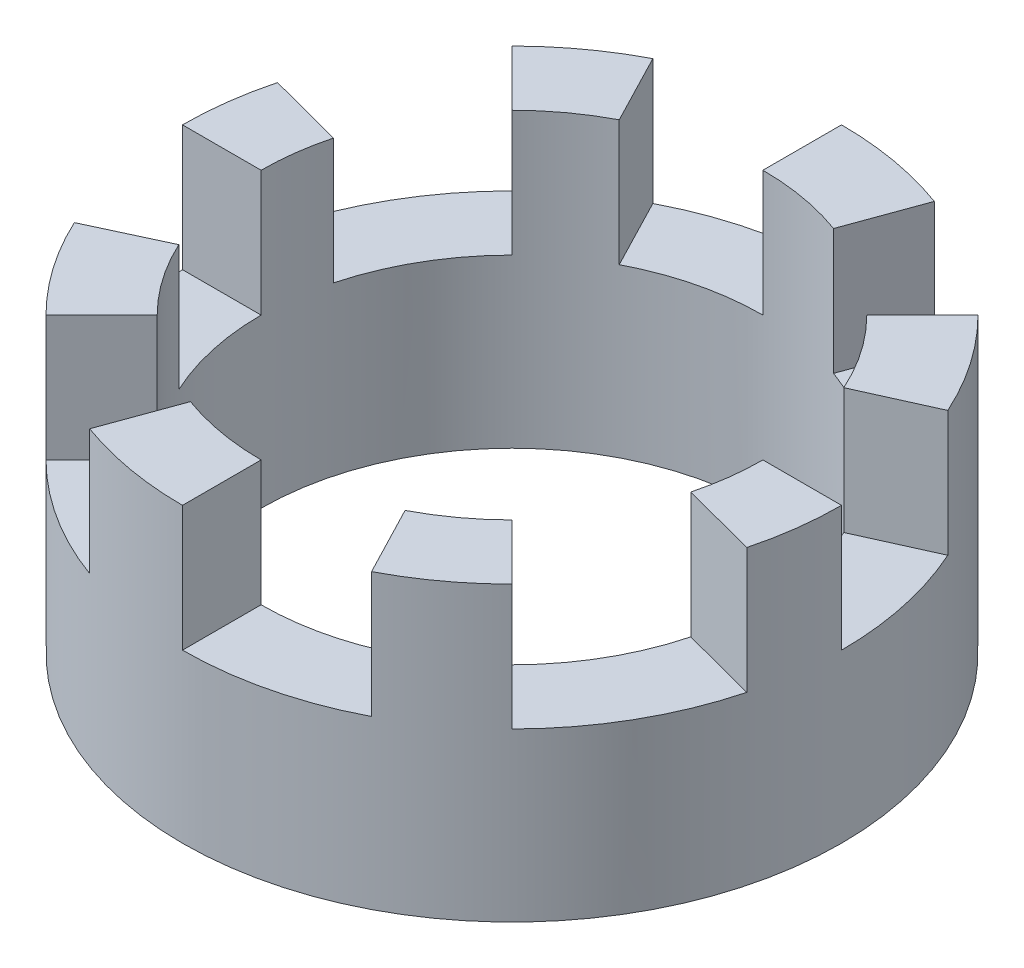
from build123d import *
from build123d.topology import SkipClean

# Parameters (mm, degrees)
SKETCH1_R           = 39.4
SKETCH1_R_2         = 30
BOSS_EXTRUDE1_DEPTH = 20
BOSS_EXTRUDE2_DEPTH = 15


with BuildPart() as part:
    # Sketch1 → Boss-Extrude1 (new body)
    with BuildSketch(Plane(origin=(0, 0, 0), x_dir=(1, 0, 0), z_dir=(0, 1, 0))):
        with Locations(Location((0, 0, 0), (0, 0, 270))):
            Circle(SKETCH1_R)
        with Locations(Location((0, 0, 0), (0, 0, 270))):
            Circle(SKETCH1_R_2, mode=Mode.SUBTRACT)
    extrude(amount=BOSS_EXTRUDE1_DEPTH)

    # Sketch2 → Boss-Extrude2 (add)
    with SkipClean():  # the faces are left unmerged after this step: merging them gives an invalid solid
        with BuildSketch(Plane(origin=(0, 20, 0), x_dir=(1, 0, 0), z_dir=(0, 1, 0))):
            with BuildLine():
                Line((-29.006131017, 7.657960788), (-38.094718735, 10.057455169))
                ThreePointArc((-38.094718735, 10.057455169), (-39.072317043, 5.070901391), (-39.4, 0))
                Line((-39.4, 0), (-30, 0))
                ThreePointArc((-30, 0), (-29.75049521, 3.861092429), (-29.006131017, 7.657960788))
            make_face()
            with BuildLine():
                Line((-27.21258864, -12.628341916), (-35.739199747, -16.585222382))
                ThreePointArc((-35.739199747, -16.585222382), (-32.295432702, -22.569116655), (-27.860007179, -27.860007179))
                Line((-27.860007179, -27.860007179), (-21.213203436, -21.213203436))
                ThreePointArc((-21.213203436, -21.213203436), (-24.590430992, -17.18460659), (-27.21258864, -12.628341916))
            make_face()
            with BuildLine():
                Line((-10.2606043, -28.190778624), (-13.475593647, -37.023889259))
                ThreePointArc((-13.475593647, -37.023889259), (-6.8417382, -38.801425469), (0, -39.4))
                Line((0, -39.4), (0, -30))
                ThreePointArc((0, -30), (-5.20944533, -29.54423259), (-10.2606043, -28.190778624))
            make_face()
            with BuildLine():
                Line((13.833981995, -26.619935052), (18.168629687, -34.960848034))
                ThreePointArc((18.168629687, -34.960848034), (23.286569909, -31.782002169), (27.860007179, -27.860007179))
                Line((27.860007179, -27.860007179), (21.213203436, -21.213203436))
                ThreePointArc((21.213203436, -21.213203436), (17.730890794, -24.199494037), (13.833981995, -26.619935052))
            make_face()
            with BuildLine():
                Line((39.4, 0), (30, 0))
                ThreePointArc((30, 0), (29.751894914, -3.850292074), (29.011683396, -7.636899012))
                Line((29.011683396, -7.636899012), (38.10201086, -10.029794035))
                ThreePointArc((38.10201086, -10.029794035), (39.07415532, -5.056716924), (39.4, 0))
            make_face()
            with BuildLine():
                Line((27.860007179, 27.860007179), (21.213203436, 21.213203436))
                ThreePointArc((21.213203436, 21.213203436), (24.686675185, 17.046057265), (27.352889551, 12.321502878))
                Line((27.352889551, 12.321502878), (35.923461611, 16.182240447))
                ThreePointArc((35.923461611, 16.182240447), (32.42183341, 22.387155208), (27.860007179, 27.860007179))
            make_face()
            with BuildLine():
                ThreePointArc((13.475593647, 37.023889259), (6.8417382, 38.801425469), (0, 39.4))
                Line((0, 39.4), (0, 30))
                ThreePointArc((0, 30), (5.20944533, 29.54423259), (10.2606043, 28.190778624))
                Line((10.2606043, 28.190778624), (13.475593647, 37.023889259))
            make_face()
            with BuildLine():
                ThreePointArc((-18.13649628, 34.977528539), (-23.271965112, 31.792697901), (-27.860007179, 27.860007179))
                Line((-27.860007179, 27.860007179), (-21.213203436, 21.213203436))
                ThreePointArc((-21.213203436, 21.213203436), (-17.71977039, 24.207637996), (-13.809514934, 26.632635943))
                Line((-13.809514934, 26.632635943), (-18.13649628, 34.977528539))
            make_face()
        extrude(amount=BOSS_EXTRUDE2_DEPTH)


solid = part.part
